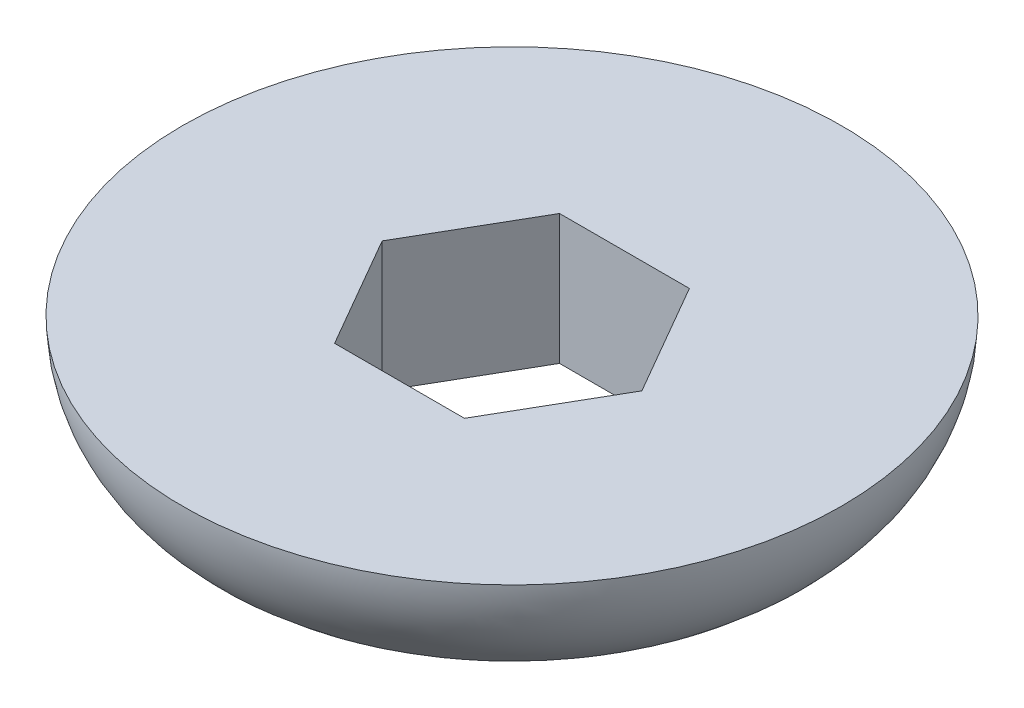
from build123d import *

# Parameters (mm, degrees)
CUT_EXTRUDE1_DEPTH = 4.8


with BuildPart() as part:
    # Sketch1 → Revolve1 (revolve)
    with BuildSketch(Plane.XY, mode=Mode.PRIVATE) as revolve1_sk:
        with BuildLine():
            Line((0, 0), (6, 0))
            ThreePointArc((6, 0), (8.904011689, 1.140264724), (10.151169128, 4))
            Line((10.151169128, 4), (0, 4))
            Line((0, 4), (0, 0))
        make_face()
    revolve(revolve1_sk.sketch.rotate(Axis((0, 4, 0), (0, -1, 0)), 180), axis=Axis((0, 4, 0), (0, -1, 0)))

    # Sketch2 → Cut-Extrude1 (cut)
    with BuildSketch(Plane.XZ):
        Polygon((4, 0), (2, 3.464101615), (-2, 3.464101615), (-4, 0), (-2, -3.464101615), (2, -3.464101615), align=None)
    extrude(amount=-CUT_EXTRUDE1_DEPTH, mode=Mode.SUBTRACT)


solid = part.part
